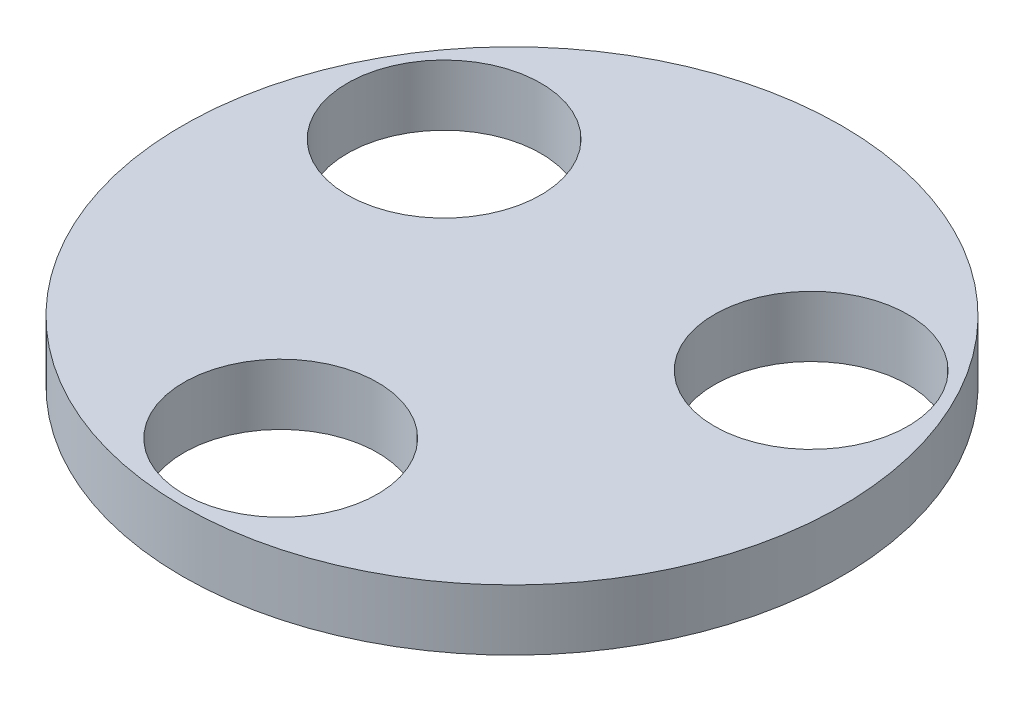
from build123d import *

# Parameters (mm, degrees)
SKETCH3_R           = 32.5
BOSS_EXTRUDE1_DEPTH = 6
SKETCH7_R           = 9.55
CUT_EXTRUDE1_DEPTH  = 10


with BuildPart() as part:
    # Sketch3 → Boss-Extrude1 (new body)
    with BuildSketch(Plane(origin=(0, 0, 0), x_dir=(1, 0, 0), z_dir=(0, 1, 0))):
        with Locations(Location((0, 0, 0), (0, 0, 270))):
            Circle(SKETCH3_R)
    extrude(amount=BOSS_EXTRUDE1_DEPTH)

    # Sketch7 → Cut-Extrude1 (cut)
    with BuildSketch(Plane(origin=(0, 6, 0), x_dir=(1, 0, 0), z_dir=(0, 1, 0))):
        with Locations(Location((-0.954174099, -21.854179847, 0), (0, 0, 270))):
            Circle(SKETCH7_R)
        with Locations(Location((-18.449187877, 11.753428933, 0), (0, 0, 270))):
            Circle(SKETCH7_R)
        with Locations(Location((19.403361976, 10.100750915, 0), (0, 0, 270))):
            Circle(SKETCH7_R)
    extrude(amount=-CUT_EXTRUDE1_DEPTH, mode=Mode.SUBTRACT)


solid = part.part
